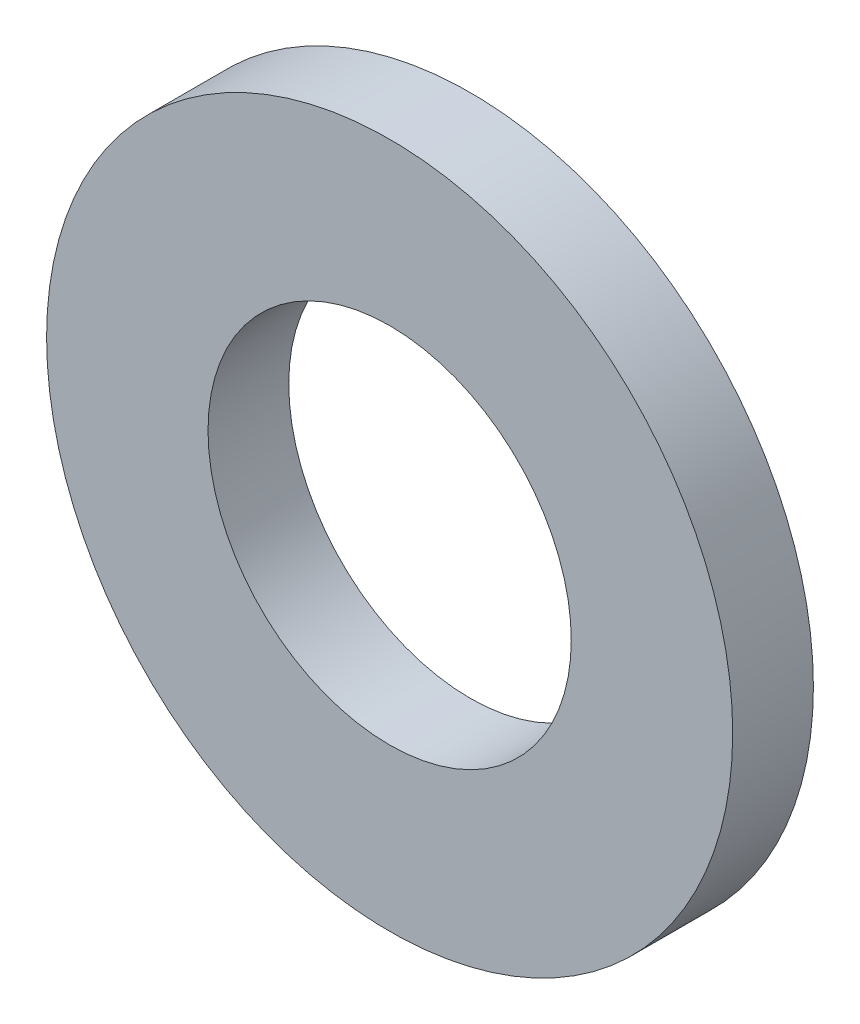
from build123d import *

# Parameters (mm, degrees)
SKETCH1_R           = 42.5
SKETCH1_R_2         = 22.5
BOSS_EXTRUDE1_DEPTH = 10


with BuildPart() as part:
    # Sketch1 → Boss-Extrude1 (new body)
    with BuildSketch(Plane.XY):
        Circle(SKETCH1_R)
        Circle(SKETCH1_R_2, mode=Mode.SUBTRACT)
    extrude(amount=BOSS_EXTRUDE1_DEPTH)


solid = part.part
